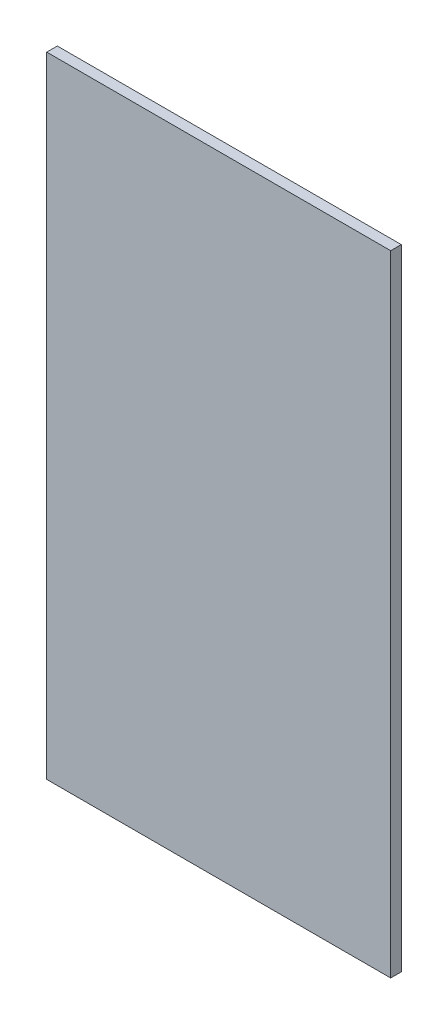
from build123d import *

# Parameters (mm, degrees)
ESQUISSE1_W        = 162.5
ESQUISSE1_H        = 297.6
BOSS_EXTRU_2_DEPTH = 5


with BuildPart() as part:
    # Esquisse1 → Boss.-Extru.2 (new body)
    with BuildSketch(Plane.XY):
        with Locations((-0.891756472, 68.968480429)):
            Rectangle(ESQUISSE1_W, ESQUISSE1_H)
    extrude(amount=BOSS_EXTRU_2_DEPTH)


solid = part.part
